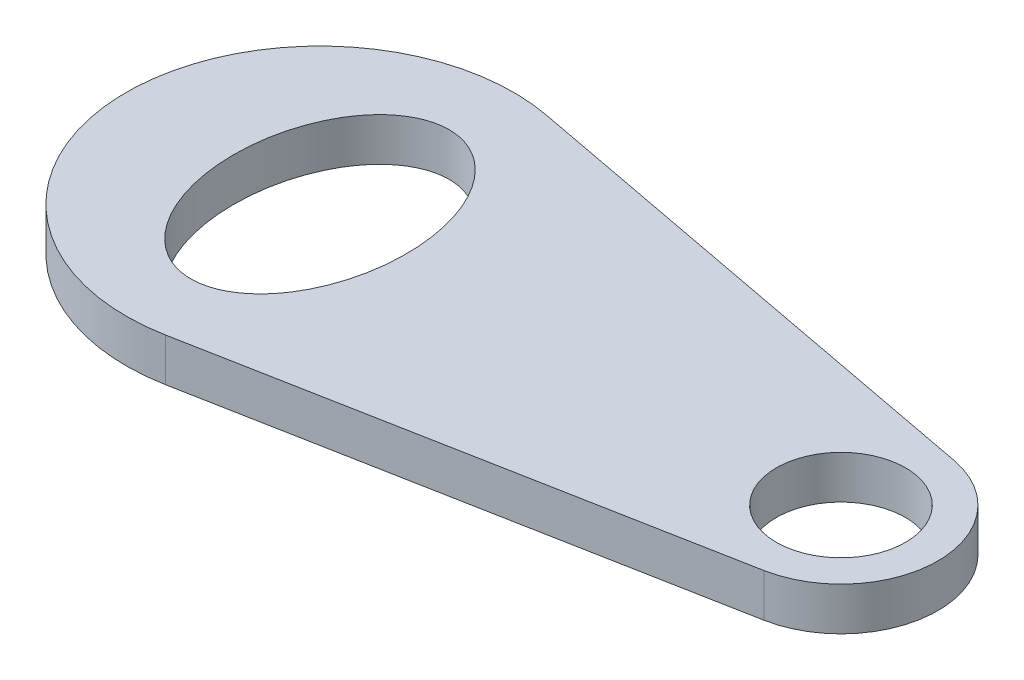
from build123d import *

# Parameters (mm, degrees)
SKETCH1_R           = 15
SKETCH1_RX          = 30
SKETCH1_RY          = 20
BOSS_EXTRUDE1_DEPTH = 10


with BuildPart() as part:
    # Sketch1 → Boss-Extrude1 (new body)
    with BuildSketch(Plane(origin=(0, 0, 0), x_dir=(1, 0, 0), z_dir=(0, 1, 0))):
        with BuildLine():
            Line((-34.444842367, 44.214814759), (82.343924077, 22.10740738))
            ThreePointArc((82.343924077, 22.10740738), (100.659125522, 0), (82.343924077, -22.10740738))
            Line((82.343924077, -22.10740738), (-34.444842367, -44.214814759))
            ThreePointArc((-34.444842367, -44.214814759), (-87.814439477, 0), (-34.444842367, 44.214814759))
        make_face()
        with Locations(Location((78.159125522, 0, 0), (0, 0, 270))):
            Circle(SKETCH1_R, mode=Mode.SUBTRACT)
        with Locations(Location((-42.814439477, 0), (0, 0, 90))):
            Ellipse(SKETCH1_RX, SKETCH1_RY, mode=Mode.SUBTRACT)
    extrude(amount=BOSS_EXTRUDE1_DEPTH)


solid = part.part
